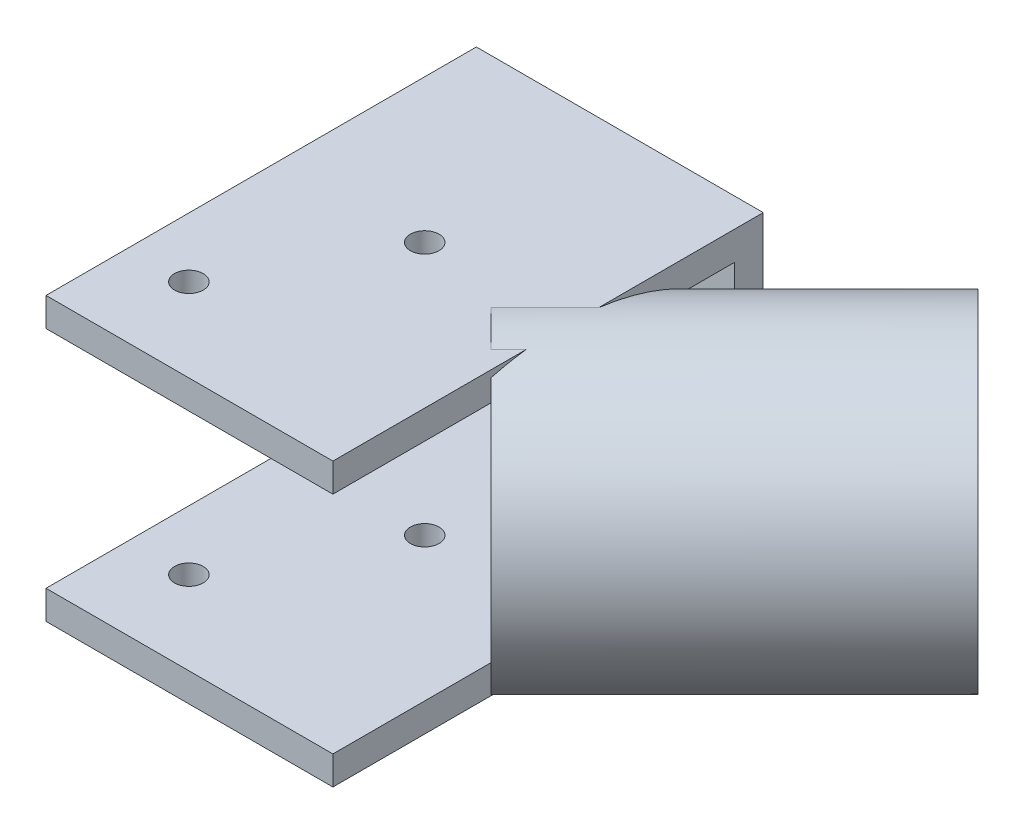
from build123d import *

# Parameters (mm, degrees)
ESQUISSE1_W                  = 50
ESQUISSE1_H                  = 49.2
BOSS_EXTRU_1_DEPTH           = 5
ESQUISSE4_W                  = 50
ESQUISSE4_H                  = 5
BOSS_EXTRU_3_DEPTH           = 70
ESQUISSE5_R                  = 10
ESQUISSE5_R_2                = 1.25
ENL_V_MAT_EXTRU_1_DEPTH      = 100.099142277
ESQUISSE6_R                  = 11
ENL_V_MAT_EXTRU_2_DEPTH      = 2
ENL_V_MAT_EXTRU_3_DEPTH      = 103.69196658
ENL_V_MAT_EXTRU_3_DEPTH_BACK = 103.69196658
ESQUISSE7_R                  = 2.5
ESQUISSE8_R                  = 2.5
ENL_V_MAT_EXTRU_4_DEPTH      = 103.69196658
ESQUISSE10_R                 = 25
ESQUISSE10_R_2               = 15
BOSS_EXTRU_4_DEPTH           = 30
ESQUISSE12_W                 = 50
ESQUISSE12_H                 = 70
ENL_V_MAT_EXTRU_6_DEPTH      = 39.2


with BuildPart() as part:
    # Esquisse1 → Boss.-Extru.1 (new body)
    with BuildSketch(Plane.XY):
        with Locations((25, 24.6)):
            Rectangle(ESQUISSE1_W, ESQUISSE1_H)
    extrude(amount=BOSS_EXTRU_1_DEPTH)

    # Esquisse4 → Boss.-Extru.3 (add)
    with BuildSketch(Plane.XY.offset(5)):
        with Locations((25, 46.7)):
            Rectangle(ESQUISSE4_W, ESQUISSE4_H)
        with Locations((25, 2.5)):
            Rectangle(ESQUISSE4_W, ESQUISSE4_H)
    extrude(amount=BOSS_EXTRU_3_DEPTH)

    # Esquisse5 → Enlèv. mat.-Extru.1 (cut, through all)
    with BuildSketch(Plane.XY.offset(5)):
        with Locations((25, 24.6)):
            Circle(ESQUISSE5_R)
        with Locations((9.3, 8.9)):
            Circle(ESQUISSE5_R_2)
        with Locations((40.7, 40.3)):
            Circle(ESQUISSE5_R_2)
        with Locations((40.7, 8.9)):
            Circle(ESQUISSE5_R_2)
        with Locations((9.3, 40.3)):
            Circle(ESQUISSE5_R_2)
    extrude(amount=-ENL_V_MAT_EXTRU_1_DEPTH, mode=Mode.SUBTRACT)

    # Esquisse6 → Enlèv. mat.-Extru.2 (cut)
    with BuildSketch(Plane(origin=(0, 0, 0), x_dir=(-1, 0, 0), z_dir=(0, 0, -1))):
        with Locations((-25, 24.6)):
            Circle(ESQUISSE6_R)
    extrude(amount=-ENL_V_MAT_EXTRU_2_DEPTH, mode=Mode.SUBTRACT)

    # Esquisse7 → Enlèv. mat.-Extru.3 (cut, two sides: drawn at the far end of the back side and taken through both)
    with BuildSketch(Plane.XZ.offset(-ENL_V_MAT_EXTRU_3_DEPTH_BACK)):
        with Locations(Location((25, 34, 0), (0, 0, 270))):
            Circle(ESQUISSE7_R)
    extrude(amount=ENL_V_MAT_EXTRU_3_DEPTH + ENL_V_MAT_EXTRU_3_DEPTH_BACK, mode=Mode.SUBTRACT)

    # Esquisse8 → Enlèv. mat.-Extru.4 (cut, through all)
    with BuildSketch(Plane.XZ):
        with Locations(Location((10.4, 60.5, 0), (0, 0, 270))):
            Circle(ESQUISSE8_R)
    extrude(amount=-ENL_V_MAT_EXTRU_4_DEPTH, mode=Mode.SUBTRACT)

    # Esquisse10 → Boss.-Extru.4 (add, symmetric)
    with BuildSketch(Plane(origin=(50, 5, 5), x_dir=(0.7071067811865476, 0, 0.7071067811865475), z_dir=(-0.7071067811865475, 0, 0.7071067811865476))):
        with Locations(Location((21.226499819, 19.6, 0), (0, 0, 231.628284853))):
            Circle(ESQUISSE10_R)
        with Locations((21.226499819, 19.6)):
            Circle(ESQUISSE10_R_2, mode=Mode.SUBTRACT)
    extrude(amount=BOSS_EXTRU_4_DEPTH, both=True)

    # Esquisse12 → Enlèv. mat.-Extru.6 (cut)
    with BuildSketch(Plane(origin=(0, 5, 0), x_dir=(1, 0, 0), z_dir=(0, 1, 0))):
        with Locations((25, -40)):
            Rectangle(ESQUISSE12_W, ESQUISSE12_H)
    extrude(amount=ENL_V_MAT_EXTRU_6_DEPTH, mode=Mode.SUBTRACT)


solid = part.part
